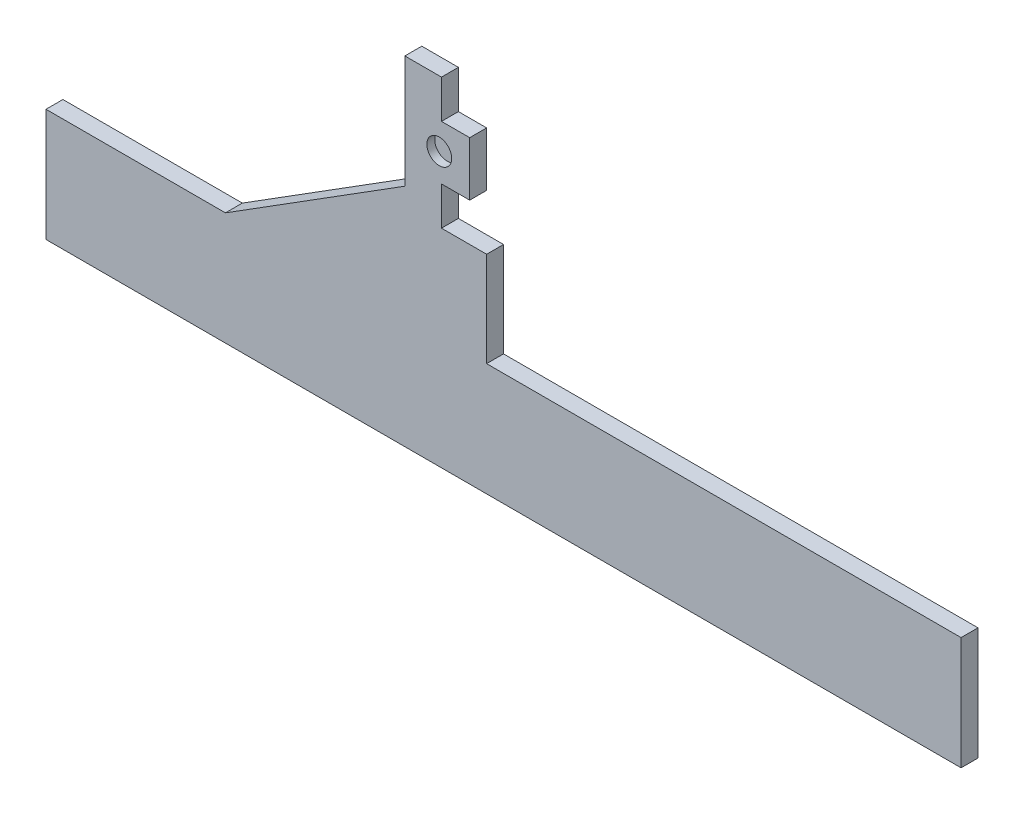
from build123d import *

# Parameters (mm, degrees)
SALIENTE_EXTRUIR1_DEPTH = 15
CROQUIS4_R              = 11
CORTAR_EXTRUIR1_DEPTH   = 7


with BuildPart() as part:
    # Croquis1 → Saliente-Extruir1 (new body)
    with BuildSketch(Plane.XY):
        Polygon((-15, 50), (-15, 134), (-55, 134), (-55, 168), (-30, 168), (-30, 216), (-55, 216), (-55, 250), (-87.48, 250), (-87.48, 150), (-246.54, 50), (-405.6, 50), (-405.6, -50), (405.6, -50), (405.6, 50), align=None)
    extrude(amount=SALIENTE_EXTRUIR1_DEPTH)

    # Croquis4 → Cortar-Extruir1 (cut)
    with BuildSketch(Plane.XY.offset(15)):
        with Locations((-56.98, 192)):
            Circle(CROQUIS4_R)
    extrude(amount=-CORTAR_EXTRUIR1_DEPTH, mode=Mode.SUBTRACT)


solid = part.part
